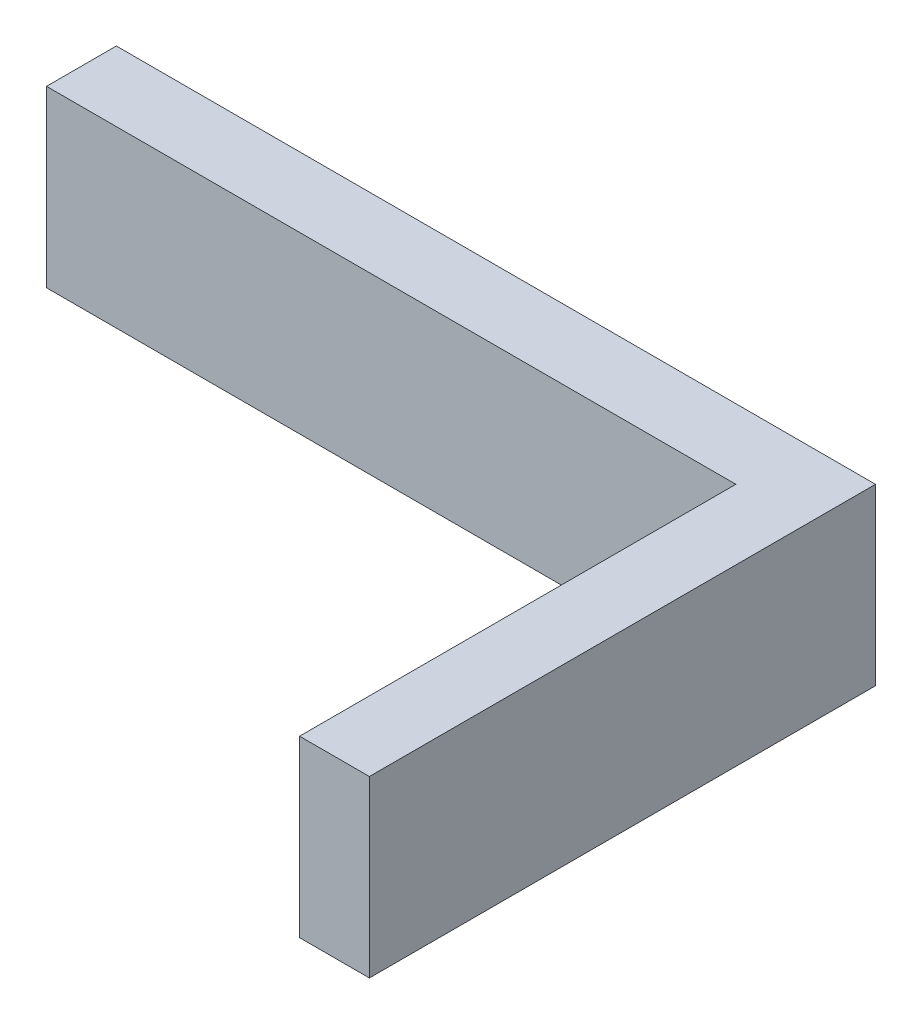
from build123d import *

# Parameters (mm, degrees)
SKETCH1_W           = 43.5
SKETCH1_H           = 10
BOSS_EXTRUDE1_DEPTH = 4
SKETCH2_W           = 4
SKETCH2_H           = 10
BOSS_EXTRUDE2_DEPTH = 25


with BuildPart() as part:
    # Sketch1 → Boss-Extrude1 (new body)
    with BuildSketch(Plane.XY):
        with Locations((21.75, 5)):
            Rectangle(SKETCH1_W, SKETCH1_H)
    extrude(amount=BOSS_EXTRUDE1_DEPTH)

    # Sketch2 → Boss-Extrude2 (add)
    with BuildSketch(Plane.XY.offset(4)):
        with Locations((41.5, 5)):
            Rectangle(SKETCH2_W, SKETCH2_H)
    extrude(amount=BOSS_EXTRUDE2_DEPTH)


solid = part.part
